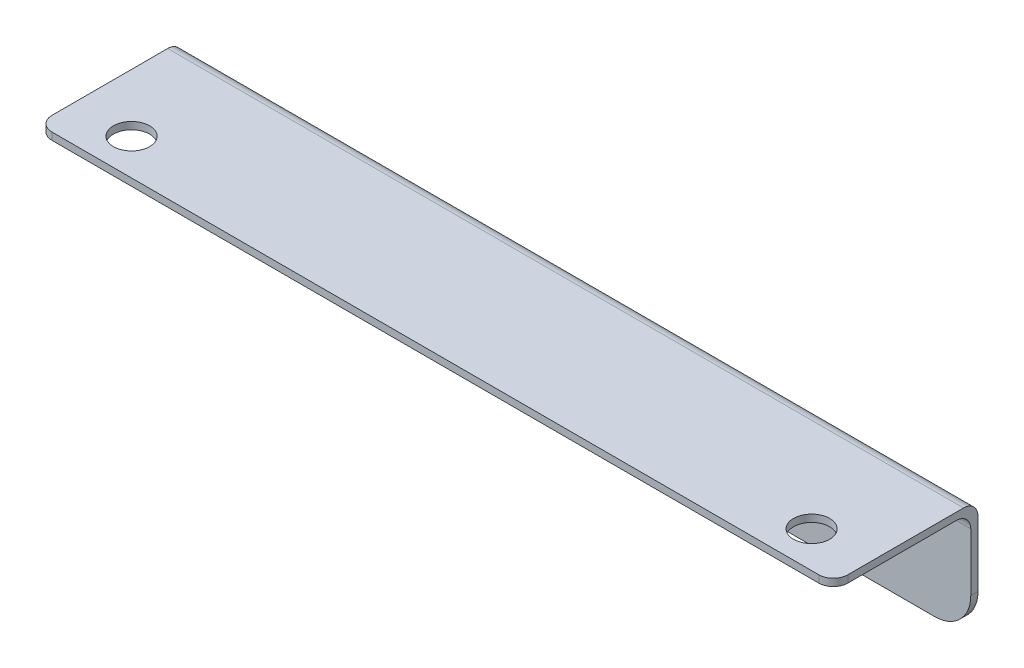
from build123d import *

# Parameters (mm, degrees)
SKETCH1_R           = 3
BOSS_EXTRUDE1_DEPTH = 1
SKETCH2_W           = 110
SKETCH2_H           = 20
SKETCH2_R           = 2.5
BOSS_EXTRUDE2_DEPTH = 1
FILLET1_R           = 2


with BuildPart() as part:
    # Sketch1 → Boss-Extrude1 (new body)
    with BuildSketch(Plane.XY):
        with BuildLine():
            Line((-55, 0), (55, 0))
            Line((55, 0), (55, -10))
            ThreePointArc((55, -10), (53.535533906, -13.535533906), (50, -15))
            Line((50, -15), (-50, -15))
            ThreePointArc((-50, -15), (-53.535533906, -13.535533906), (-55, -10))
            Line((-55, -10), (-55, 0))
        make_face()
        with Locations((40, -7.5)):
            Circle(SKETCH1_R, mode=Mode.SUBTRACT)
        with Locations(Location((-40, -7.5, 0), (0, 0, 180))):
            Circle(SKETCH1_R, mode=Mode.SUBTRACT)
    extrude(amount=BOSS_EXTRUDE1_DEPTH)

    # Sketch2 → Boss-Extrude2 (add)
    with BuildSketch(Plane(origin=(0, 0, 0), x_dir=(1, 0, 0), z_dir=(0, 1, 0))):
        with Locations((0, -10)):
            Rectangle(SKETCH2_W, SKETCH2_H)
        with Locations(Location((47, -15, 0), (0, 0, 270))):
            Circle(SKETCH2_R, mode=Mode.SUBTRACT)
        with Locations(Location((-47, -15, 0), (0, 0, 90))):
            Circle(SKETCH2_R, mode=Mode.SUBTRACT)
    extrude(amount=BOSS_EXTRUDE2_DEPTH)

    # Fillet1
    fillet1_edges = [part.edges().sort_by_distance(p)[0] for p in [
        (0, 0, 1),
        (0, 1, 0),
        (55, 0.5, 20),
        (-55, 0.5, 20),
    ]]
    fillet(fillet1_edges, radius=FILLET1_R)


solid = part.part
